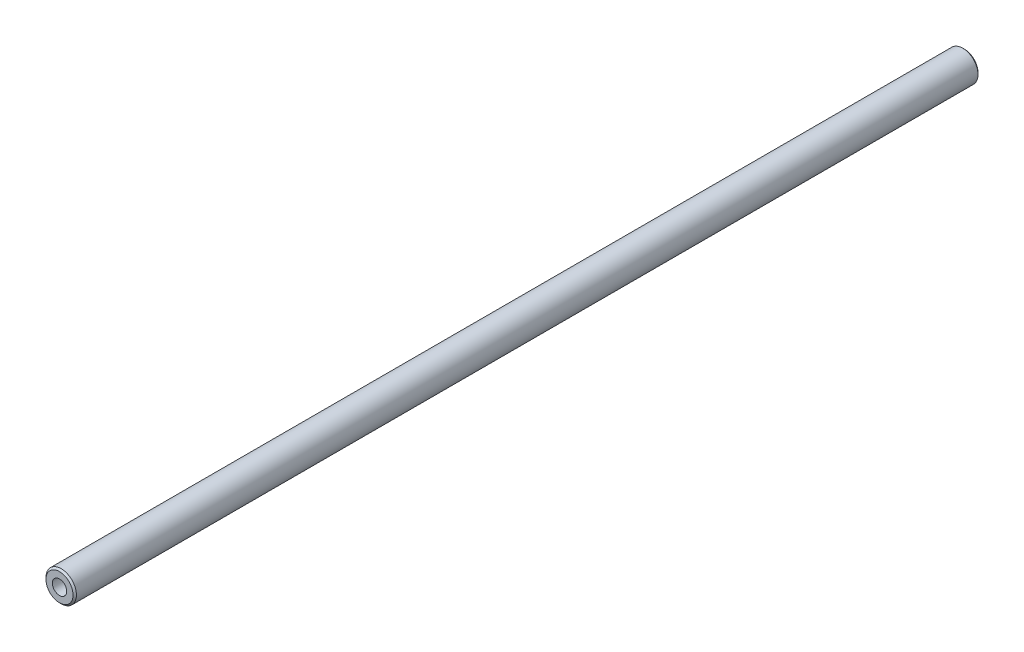
from build123d import *

# Parameters (mm, degrees)
SKIZZE1_R                    = 9
BASIS_LINEAR_AUSTRAGEN_DEPTH = 267.5
FASE1_SIZE                   = 1
BOHRUNG1_D                   = 8.5
BOHRUNG1_DEPTH               = 23
BOHRUNG1_TIP                 = 2.553657631


with BuildPart() as part:
    # Skizze1 → Basis-Linear austragen (new, symmetric)
    with BuildSketch(Plane.XY):
        Circle(SKIZZE1_R)
    extrude(amount=BASIS_LINEAR_AUSTRAGEN_DEPTH, both=True)

    # Fase1
    fase1_edges = [part.edges().sort_by_distance(p)[0] for p in [
        (-9, 0, -267.5),
        (-9, 0, 267.5),
    ]]
    chamfer(fase1_edges, length=FASE1_SIZE)

    # Bohrung1
    with Locations(Plane.XY.offset(267.5)):
        with Locations((0, 0)):
            Hole(BOHRUNG1_D / 2, depth=BOHRUNG1_DEPTH)
            with Locations((0, 0, -(BOHRUNG1_DEPTH + BOHRUNG1_TIP / 2))):  # 118° drill point
                Cone(0, BOHRUNG1_D / 2, BOHRUNG1_TIP, mode=Mode.SUBTRACT)


solid = part.part
